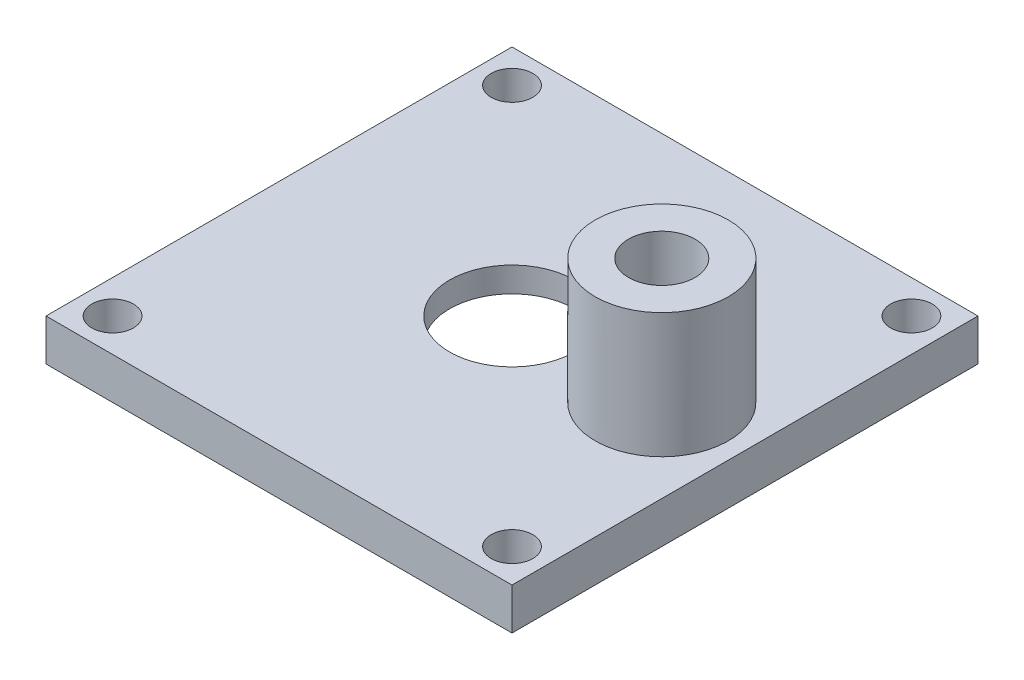
from build123d import *

# Parameters (mm, degrees)
SKETCH1_W               = 56
SKETCH1_H               = 56
BOSS_EXTRUDE1_DEPTH     = 5
SKETCH2_R               = 8
BOSS_EXTRUDE2_DEPTH     = 15
SKETCH4_R               = 19
CUT_EXTRUDE2_DEPTH      = 2
CUT_EXTRUDE3_DEPTH      = 44.497126342
CUT_EXTRUDE3_DEPTH_BACK = 44.497126342
SKETCH5_R               = 7.5
SKETCH6_R               = 4
CUT_EXTRUDE4_DEPTH      = 15
SKETCH7_R               = 2.5
CUT_EXTRUDE5_DEPTH      = 43.343830719


with BuildPart() as part:
    # Sketch1 → Boss-Extrude1 (new body)
    with BuildSketch(Plane(origin=(0, 0, 0), x_dir=(1, 0, 0), z_dir=(0, 1, 0))):
        Rectangle(SKETCH1_W, SKETCH1_H)
    extrude(amount=BOSS_EXTRUDE1_DEPTH)

    # Sketch2 → Boss-Extrude2 (add)
    with BuildSketch(Plane(origin=(0, 5, 0), x_dir=(1, 0, 0), z_dir=(0, 1, 0))):
        with Locations(Location((18, 0, 0), (0, 0, 90))):
            Circle(SKETCH2_R)
    extrude(amount=BOSS_EXTRUDE2_DEPTH)

    # Sketch4 → Cut-Extrude2 (cut)
    with BuildSketch(Plane.XZ):
        with Locations(Location((0, 0, 0), (0, 0, 270))):
            Circle(SKETCH4_R)
    extrude(amount=-CUT_EXTRUDE2_DEPTH, mode=Mode.SUBTRACT)

    # Sketch5 → Cut-Extrude3 (cut, two sides: drawn at the far end of the back side and taken through both)
    with BuildSketch(Plane.XZ.offset(-2).offset(-CUT_EXTRUDE3_DEPTH_BACK)):
        with Locations(Location((0, 0, 0), (0, 0, 270))):
            Circle(SKETCH5_R)
    extrude(amount=CUT_EXTRUDE3_DEPTH + CUT_EXTRUDE3_DEPTH_BACK, mode=Mode.SUBTRACT)

    # Sketch6 → Cut-Extrude4 (cut)
    with BuildSketch(Plane(origin=(0, 20, 0), x_dir=(1, 0, 0), z_dir=(0, 1, 0))):
        with Locations(Location((18, 0, 0), (0, 0, 270))):
            Circle(SKETCH6_R)
    extrude(amount=-CUT_EXTRUDE4_DEPTH, mode=Mode.SUBTRACT)

    # Sketch7 → Cut-Extrude5 (cut, through all)
    with BuildSketch(Plane(origin=(0, 5, 0), x_dir=(1, 0, 0), z_dir=(0, 1, 0))):
        with Locations(Location((-24, 24, 0), (0, 0, 270))):
            Circle(SKETCH7_R)
        with Locations(Location((24, 24, 0), (0, 0, 270))):
            Circle(SKETCH7_R)
        with Locations(Location((24, -24, 0), (0, 0, 270))):
            Circle(SKETCH7_R)
        with Locations(Location((-24, -24, 0), (0, 0, 270))):
            Circle(SKETCH7_R)
    extrude(amount=-CUT_EXTRUDE5_DEPTH, mode=Mode.SUBTRACT)


solid = part.part
